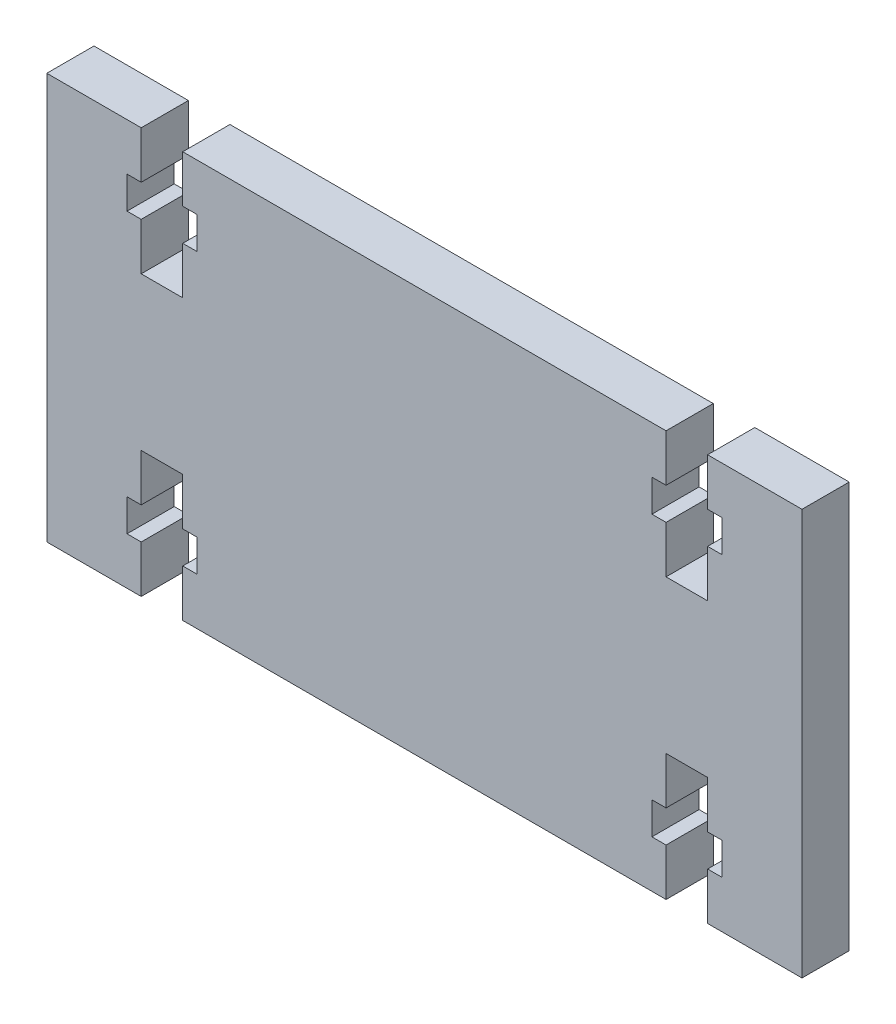
from build123d import *

# Parameters (mm, degrees)
SKETCH1_W           = 80
SKETCH1_H           = 43
BOSS_EXTRUDE1_DEPTH = 5
CUT_EXTRUDE1_DEPTH  = 5


with BuildPart() as part:
    # Sketch1 → Boss-Extrude1 (new body)
    with BuildSketch(Plane.XY):
        Rectangle(SKETCH1_W, SKETCH1_H)
    extrude(amount=BOSS_EXTRUDE1_DEPTH)

    # Sketch3 → Cut-Extrude1 (cut)
    with BuildSketch(Plane.XY.offset(5)):
        Polygon((30, -21.5), (30, -16.5), (31.5, -16.5), (31.5, -13.1), (30, -13.1), (30, -8.1), (25.6, -8.1), (25.6, -13.1), (24.1, -13.1), (24.1, -16.5), (25.6, -16.5), (25.6, -21.5), align=None)
        Polygon((-25.6, -21.5), (-30, -21.5), (-30, -16.5), (-31.5, -16.5), (-31.5, -13.1), (-30, -13.1), (-30, -8.1), (-25.6, -8.1), (-25.6, -13.1), (-24.1, -13.1), (-24.1, -16.5), (-25.6, -16.5), align=None)
        Polygon((25.6, 21.5), (30, 21.5), (30, 16.5), (31.5, 16.5), (31.5, 13.1), (30, 13.1), (30, 8.1), (25.6, 8.1), (25.6, 13.1), (24.1, 13.1), (24.1, 16.5), (25.6, 16.5), align=None)
        Polygon((-30, 21.5), (-30, 16.5), (-31.5, 16.5), (-31.5, 13.1), (-30, 13.1), (-30, 8.1), (-25.6, 8.1), (-25.6, 13.1), (-24.1, 13.1), (-24.1, 16.5), (-25.6, 16.5), (-25.6, 21.5), align=None)
    extrude(amount=-CUT_EXTRUDE1_DEPTH, mode=Mode.SUBTRACT)


solid = part.part
